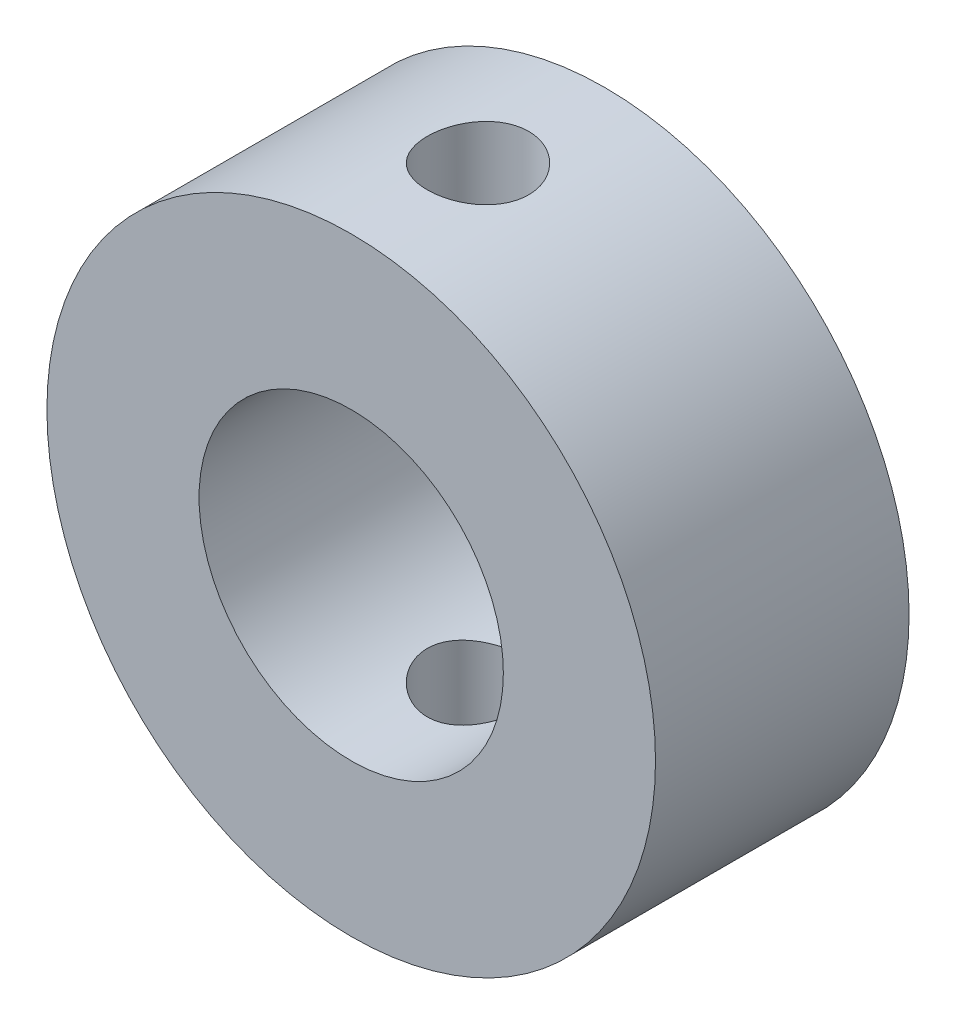
from build123d import *

# Parameters (mm, degrees)
SKIZZE1_R                            = 6
SKIZZE1_R_2                          = 3
AUFSATZ_LINEAR_AUSTRAGEN1_DEPTH      = 5
SCHNITT_LINEAR_AUSTRAGEN1_DEPTH      = 10
SCHNITT_LINEAR_AUSTRAGEN1_DEPTH_BACK = 10
SKIZZE2_R                            = 1


with BuildPart() as part:
    # Skizze1 → Aufsatz-Linear austragen1 (new body)
    with BuildSketch(Plane.XY):
        Circle(SKIZZE1_R)
        Circle(SKIZZE1_R_2, mode=Mode.SUBTRACT)
    extrude(amount=AUFSATZ_LINEAR_AUSTRAGEN1_DEPTH)

    # Skizze2 → Schnitt-Linear austragen1 (cut, two sides: drawn at the far end of the back side and taken through both)
    with BuildSketch(Plane(origin=(0, 0, 0), x_dir=(1, 0, 0), z_dir=(0, 1, 0)).offset(-SCHNITT_LINEAR_AUSTRAGEN1_DEPTH_BACK)):
        with Locations((0, -2.5)):
            Circle(SKIZZE2_R)
    extrude(amount=SCHNITT_LINEAR_AUSTRAGEN1_DEPTH + SCHNITT_LINEAR_AUSTRAGEN1_DEPTH_BACK, mode=Mode.SUBTRACT)


solid = part.part
